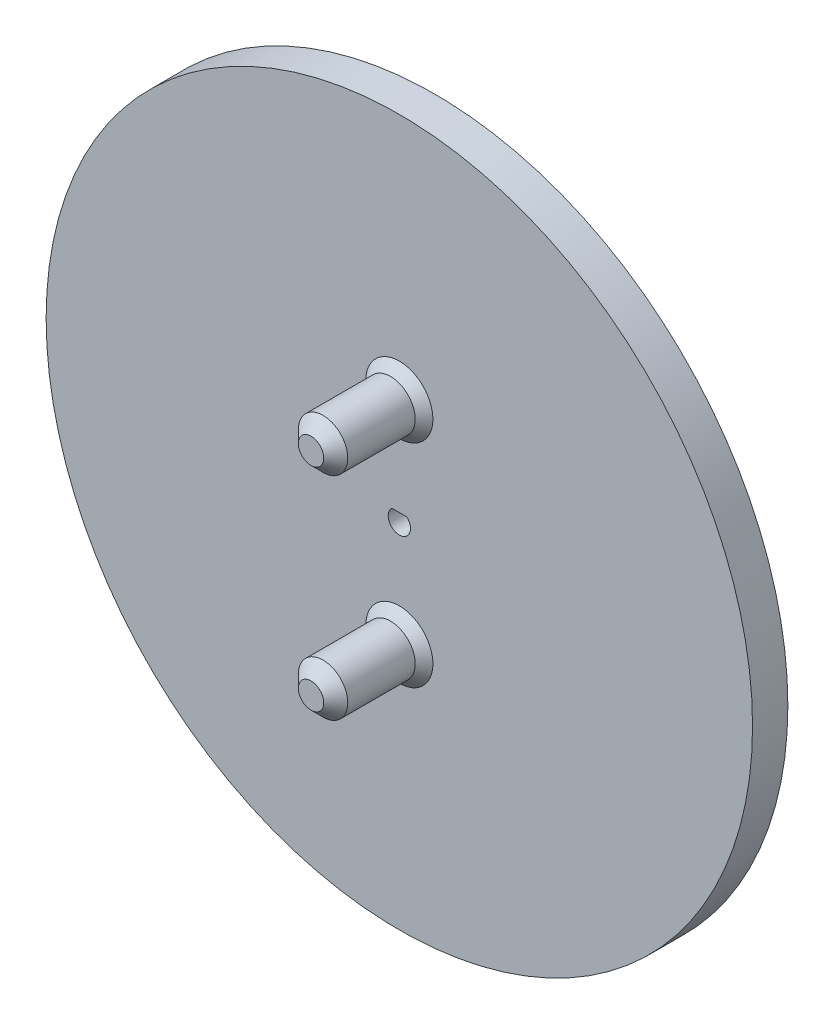
from build123d import *

# Parameters (mm, degrees)
SKETCH1_R           = 63.5
BOSS_EXTRUDE1_DEPTH = 6.35
CUT_EXTRUDE1_DEPTH  = 91.02678768
SKETCH4_R           = 4.445
BOSS_EXTRUDE2_DEPTH = 15.875
CHAMFER2_SIZE       = 2.159
CHAMFER3_SIZE       = 1.5875


with BuildPart() as part:
    # Sketch1 → Boss-Extrude1 (new body)
    with BuildSketch(Plane.XY):
        Circle(SKETCH1_R)
    extrude(amount=BOSS_EXTRUDE1_DEPTH)

    # Sketch3 → Cut-Extrude1 (cut, through all)
    with BuildSketch(Plane.XY.offset(6.35)):
        with BuildLine():
            Line((-1.322875656, 1.5), (1.322875656, 1.5))
            ThreePointArc((1.322875656, 1.5), (0, -2), (-1.322875656, 1.5))
        make_face()
    extrude(amount=-CUT_EXTRUDE1_DEPTH, mode=Mode.SUBTRACT)

    # Sketch4 → Boss-Extrude2 (add)
    with BuildSketch(Plane.XY.offset(6.35)):
        with Locations((0, 19.05)):
            Circle(SKETCH4_R)
    boss_extrude2 = extrude(amount=BOSS_EXTRUDE2_DEPTH)

    # Mirror3: Boss-Extrude2 across plane
    add(boss_extrude2.mirror(Plane.ZX))

    # Chamfer2
    chamfer2_edges = [part.edges().sort_by_distance(p)[0] for p in [
        (-4.445, 19.05, 22.225),
        (-4.445, -19.05, 22.225),
    ]]
    chamfer(chamfer2_edges, length=CHAMFER2_SIZE)

    # Chamfer3
    chamfer3_edges = [part.edges().sort_by_distance(p)[0] for p in [
        (-4.445, 19.05, 6.35),
        (-4.445, -19.05, 6.35),
    ]]
    chamfer(chamfer3_edges, length=CHAMFER3_SIZE)


solid = part.part
